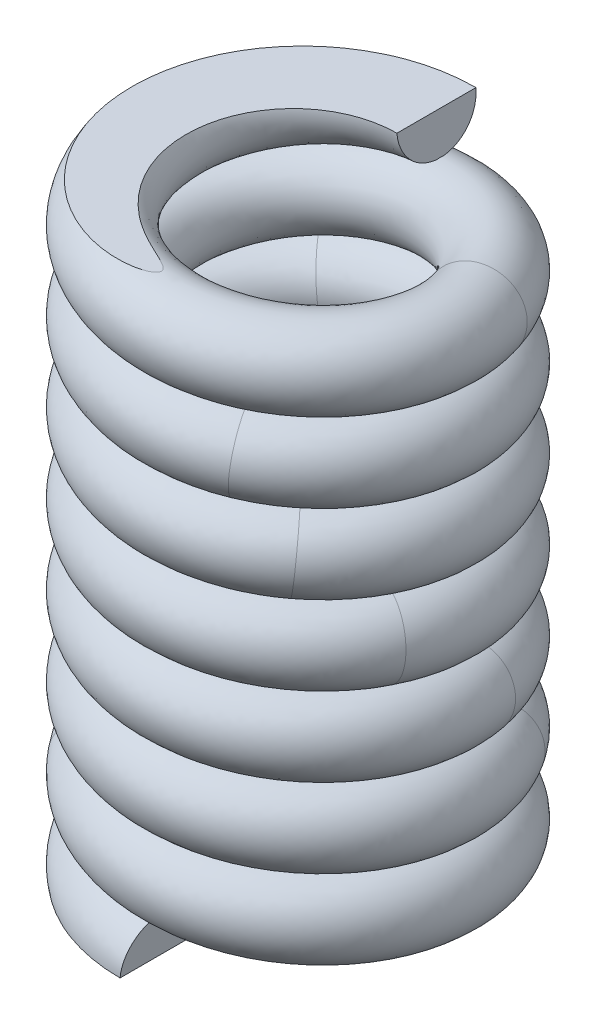
from build123d import *

# Parameters (mm, degrees)
SWEEP1_PITCH       = 2
SWEEP1_HEIGHT      = 15
SWEEP1_RADIUS      = 3.5
SWEEP1_PROFILE_R   = 1
SKETCH8_R          = 5
CUT_EXTRUDE1_DEPTH = 10
SKETCH9_R          = 5
CUT_EXTRUDE2_DEPTH = 10


with BuildPart() as part:
    # Sweep1: sweep along a helix
    with BuildLine() as sweep1_path:
        Helix(SWEEP1_PITCH, SWEEP1_HEIGHT, SWEEP1_RADIUS, center=(0, 0, 0), direction=(0, 1, 0), lefthand=True)
    # Sweep1 profile (on start of the path) → Sweep1 (sweep)
    with BuildSketch(Plane(origin=(0, 0, 3.5), x_dir=(-0.09057188775690729, -0.9958899201960778, 0), z_dir=(-0.9958899201960778, 0.09057188775690729, -6.912218000141665e-14))):
        Circle(SWEEP1_PROFILE_R)
    sweep(path=sweep1_path.line, is_frenet=True)

    # Sketch8 → Cut-Extrude1 (cut)
    with BuildSketch(Plane(origin=(0, 0, 0), x_dir=(1, 0, 0), z_dir=(0, 1, 0))):
        Circle(SKETCH8_R)
    extrude(amount=-CUT_EXTRUDE1_DEPTH, mode=Mode.SUBTRACT)

    # Sketch9 → Cut-Extrude2 (cut)
    with BuildSketch(Plane(origin=(0, 15, 0), x_dir=(-1, 0, 0), z_dir=(0, -1, 0))):
        Circle(SKETCH9_R)
    extrude(amount=-CUT_EXTRUDE2_DEPTH, mode=Mode.SUBTRACT)


solid = part.part
